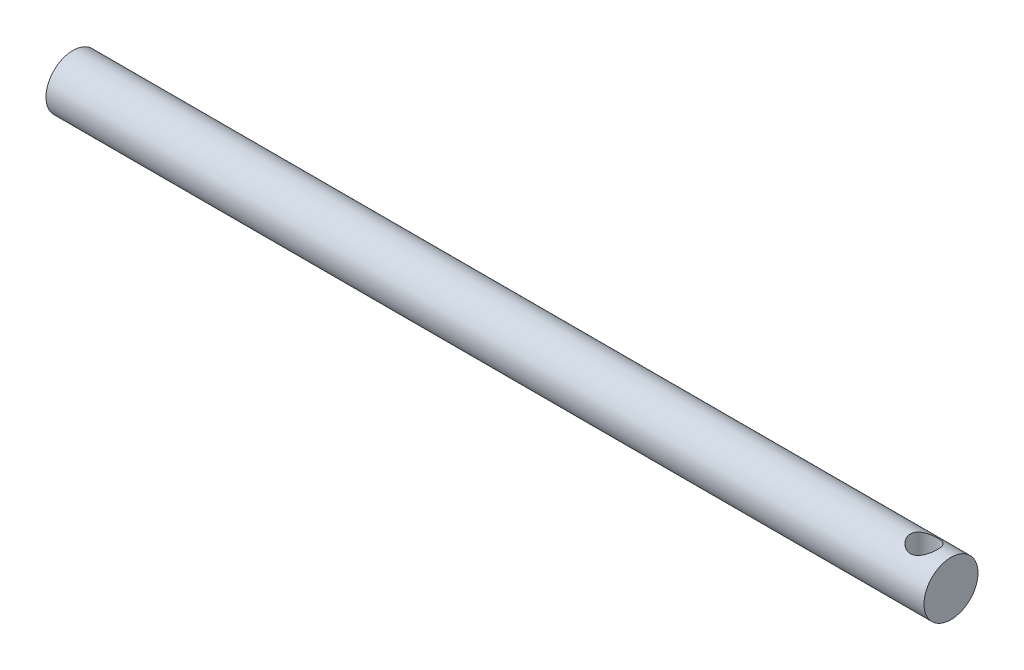
from build123d import *

# Parameters (mm, degrees)
CROQUIS1_R                 = 10
SALIENTE_EXTRUIR1_DEPTH    = 325
CORTAR_EXTRUIR1_DEPTH      = 326.307546792
CORTAR_EXTRUIR1_DEPTH_BACK = 326.307546792
CROQUIS3_R                 = 5


with BuildPart() as part:
    # Croquis1 → Saliente-Extruir1 (new body)
    with BuildSketch(Plane(origin=(0, 0, 0), x_dir=(0, 0, -1), z_dir=(1, 0, 0))):
        Circle(CROQUIS1_R)
    extrude(amount=SALIENTE_EXTRUIR1_DEPTH)

    # Croquis3 → Cortar-Extruir1 (cut, two sides: drawn at the far end of the back side and taken through both)
    with BuildSketch(Plane(origin=(0, 0, 0), x_dir=(1, 0, 0), z_dir=(0, 1, 0)).offset(-CORTAR_EXTRUIR1_DEPTH_BACK)):
        with Locations(Location((315, 0, 0), (0, 0, 270))):
            Circle(CROQUIS3_R)
    extrude(amount=CORTAR_EXTRUIR1_DEPTH + CORTAR_EXTRUIR1_DEPTH_BACK, mode=Mode.SUBTRACT)


solid = part.part
